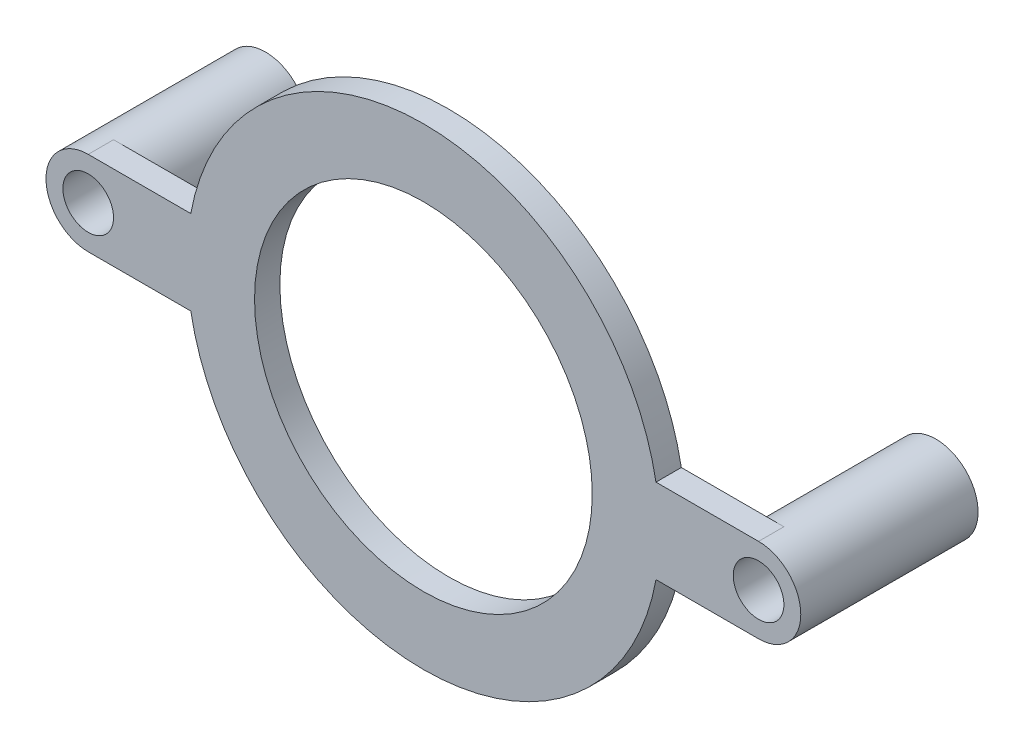
from build123d import *

# Parameters (mm, degrees)
RESSALTO_EXTRUS_O1_DEPTH         = 1.5
RESSALTO_EXTRUS_O2_START         = 22
ESBO_O2_R                        = 2.5
RESSALTO_EXTRUS_O2_DEPTH         = 22
RESSALTO_EXTRUS_O3_START         = 22
ESBO_O3_R                        = 2.5
RESSALTO_EXTRUS_O3_DEPTH         = 22
FURO_DE_DI_METRO_3_0_3_1_D       = 3
FURO_DE_DI_METRO_20_0_20_1_D     = 20
FURO_DE_DI_METRO_20_0_20_1_DEPTH = 23.5
ESBO_O8_R                        = 2.5
CORTE_EXTRUS_O1_DEPTH            = 13


with BuildPart() as part:
    # Esboço1 → Ressalto-extrusão1 (new body)
    with BuildSketch(Plane(origin=(0, 0, 0), x_dir=(-1, 0, 0), z_dir=(0, 0, -1))):
        with BuildLine():
            Line((13.774977314, -2.5), (19.85, -2.5))
            ThreePointArc((19.85, -2.5), (22.35, 0), (19.85, 2.5))
            Line((19.85, 2.5), (13.774977314, 2.5))
            ThreePointArc((13.774977314, 2.5), (0, 14), (-13.774977314, 2.5))
            Line((-13.774977314, 2.5), (-19.85, 2.5))
            ThreePointArc((-19.85, 2.5), (-22.35, 0), (-19.85, -2.5))
            Line((-19.85, -2.5), (-13.774977314, -2.5))
            ThreePointArc((-13.774977314, -2.5), (0, -14), (13.774977314, -2.5))
        make_face()
    extrude(amount=-RESSALTO_EXTRUS_O1_DEPTH)

    # Esboço2 → Ressalto-extrusão2 (add)
    with BuildSketch(Plane(origin=(0, 0, 0), x_dir=(-1, 0, 0), z_dir=(0, 0, -1)).offset(RESSALTO_EXTRUS_O2_START)):
        with Locations((-19.85, 0)):
            Circle(ESBO_O2_R)
    extrude(amount=-RESSALTO_EXTRUS_O2_DEPTH)

    # Esboço3 → Ressalto-extrusão3 (add)
    with BuildSketch(Plane(origin=(0, 0, 0), x_dir=(-1, 0, 0), z_dir=(0, 0, -1)).offset(RESSALTO_EXTRUS_O3_START)):
        with Locations((19.85, 0)):
            Circle(ESBO_O3_R)
    extrude(amount=-RESSALTO_EXTRUS_O3_DEPTH)

    # Furo de diâmetro Ø3.0 (3)1 (through all)
    with Locations(Plane(origin=(0, 0, -22), x_dir=(-1, 0, 0), z_dir=(0, 0, -1))):
        with Locations((-19.85, 0), (19.85, 0)):
            Hole(FURO_DE_DI_METRO_3_0_3_1_D / 2)

    # Furo de diâmetro Ø20.0 (20)1
    with Locations(Plane.XY.offset(1.5)):
        with Locations((0, 0)):
            Hole(FURO_DE_DI_METRO_20_0_20_1_D / 2, depth=FURO_DE_DI_METRO_20_0_20_1_DEPTH)

    # Esboço8 → Corte-extrusão1 (cut)
    with BuildSketch(Plane(origin=(0, 0, -22), x_dir=(-1, 0, 0), z_dir=(0, 0, -1))):
        with Locations((19.85, 0)):
            Circle(ESBO_O8_R)
        with Locations((-19.85, 0)):
            Circle(ESBO_O8_R)
    extrude(amount=-CORTE_EXTRUS_O1_DEPTH, mode=Mode.SUBTRACT)


solid = part.part
